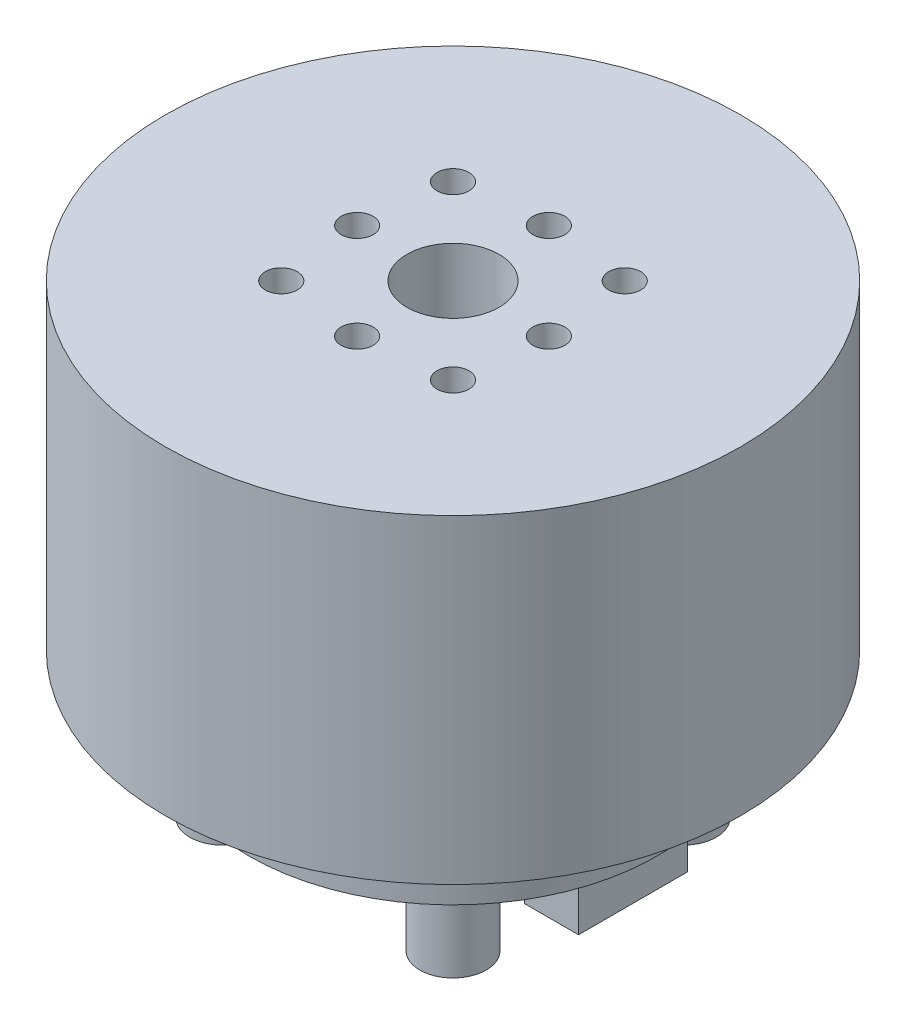
from build123d import *

# Parameters (mm, degrees)
SKETCH_1_R          = 22.5
EXTRUDE_1_DEPTH     = 25
SKETCH_2_R          = 15.96
EXTRUDE_2_DEPTH     = 6
EXTRUDE_3_DEPTH     = 5.4
SKETCH_4_W          = 4.21
SKETCH_4_H          = 8.54
SKETCH_4_H_2        = 4.27
EXTRUDE_4_DEPTH     = 4.13
SKETCH_5_R          = 1.25
CUT_EXTRUDE_1_DEPTH = 3
SKETCH_6_R          = 3.6
CUT_EXTRUDE_2_DEPTH = 25


with BuildPart() as part:
    # 草图1 → 凸台-拉伸1 (new body)
    with BuildSketch(Plane(origin=(0, 0, 0), x_dir=(1, 0, 0), z_dir=(0, 1, 0))):
        with Locations(Location((0, 0, 0), (0, 0, 270))):
            Circle(SKETCH_1_R)
    extrude(amount=EXTRUDE_1_DEPTH)

    # 草图2 → 凸台-拉伸2 (add)
    with BuildSketch(Plane.XZ):
        with Locations(Location((0, 0, 0), (0, 0, 270))):
            Circle(SKETCH_2_R)
    extrude(amount=EXTRUDE_2_DEPTH)

    # 草图3 → 凸台-拉伸3 (add)
    with BuildSketch(Plane.XZ.offset(6)):
        with BuildLine():
            ThreePointArc((-6.4, 9), (-10.838477631, 10.838477631), (-9, 6.4))
            Line((-9, 6.4), (-9, 7.6))
            ThreePointArc((-9, 7.6), (-9.989949494, 9.989949494), (-7.6, 9))
            Line((-7.6, 9), (-6.4, 9))
        make_face()
        with BuildLine():
            Line((-9, 7.6), (-9, 6.4))
            ThreePointArc((-9, 6.4), (-7.161522369, 7.161522369), (-6.4, 9))
            Line((-6.4, 9), (-7.6, 9))
            ThreePointArc((-7.6, 9), (-8.010050506, 8.010050506), (-9, 7.6))
        make_face()
        with BuildLine():
            ThreePointArc((6.4, 9), (7.161522369, 7.161522369), (9, 6.4))
            Line((9, 6.4), (9, 7.6))
            ThreePointArc((9, 7.6), (8.010050506, 8.010050506), (7.6, 9))
            Line((7.6, 9), (6.4, 9))
        make_face()
        with BuildLine():
            Line((9, 7.6), (9, 6.4))
            ThreePointArc((9, 6.4), (10.838477631, 7.161522369), (11.6, 9))
            ThreePointArc((11.6, 9), (9, 11.6), (6.4, 9))
            Line((6.4, 9), (7.6, 9))
            ThreePointArc((7.6, 9), (9, 10.4), (10.4, 9))
            ThreePointArc((10.4, 9), (9.989949494, 8.010050506), (9, 7.6))
        make_face()
        with BuildLine():
            ThreePointArc((9, -6.4), (7.161522369, -7.161522369), (6.4, -9))
            Line((6.4, -9), (7.6, -9))
            ThreePointArc((7.6, -9), (8.010050506, -8.010050506), (9, -7.6))
            Line((9, -7.6), (9, -6.4))
        make_face()
        with BuildLine():
            Line((7.6, -9), (6.4, -9))
            ThreePointArc((6.4, -9), (9, -11.6), (11.6, -9))
            ThreePointArc((11.6, -9), (10.838477631, -7.161522369), (9, -6.4))
            Line((9, -6.4), (9, -7.6))
            ThreePointArc((9, -7.6), (9.989949494, -8.010050506), (10.4, -9))
            ThreePointArc((10.4, -9), (9, -10.4), (7.6, -9))
        make_face()
        with BuildLine():
            ThreePointArc((-9, -7.6), (-8.010050506, -8.010050506), (-7.6, -9))
            Line((-7.6, -9), (-6.4, -9))
            ThreePointArc((-6.4, -9), (-7.161522369, -7.161522369), (-9, -6.4))
            Line((-9, -6.4), (-9, -7.6))
        make_face()
        with BuildLine():
            Line((-6.4, -9), (-7.6, -9))
            ThreePointArc((-7.6, -9), (-9.989949494, -9.989949494), (-9, -7.6))
            Line((-9, -7.6), (-9, -6.4))
            ThreePointArc((-9, -6.4), (-10.838477631, -10.838477631), (-6.4, -9))
        make_face()
    extrude(amount=EXTRUDE_3_DEPTH)

    # 草图4 → 凸台-拉伸4 (add)
    with BuildSketch(Plane.XZ.offset(6)):
        with Locations((-11.985, 0)):
            Rectangle(SKETCH_4_W, SKETCH_4_H)
        with Locations((11.985, -2.135)):
            Rectangle(SKETCH_4_W, SKETCH_4_H_2)
        with Locations((11.985, 2.135)):
            Rectangle(SKETCH_4_W, SKETCH_4_H_2)
    extrude(amount=EXTRUDE_4_DEPTH)

    # 草图5 → 切除-拉伸1 (cut)
    with BuildSketch(Plane(origin=(0, 25, 0), x_dir=(1, 0, 0), z_dir=(0, 1, 0))):
        with Locations(Location((7.5, 0, 0), (0, 0, 270))):
            Circle(SKETCH_5_R)
        with Locations(Location((-7.5, 0, 0), (0, 0, 270))):
            Circle(SKETCH_5_R)
        with Locations(Location((0, 7.5, 0), (0, 0, 270))):
            Circle(SKETCH_5_R)
        with Locations(Location((0, -7.5, 0), (0, 0, 270))):
            Circle(SKETCH_5_R)
        with Locations(Location((6.717514421, 6.717514421, 0), (0, 0, 270))):
            Circle(SKETCH_5_R)
        with Locations(Location((-6.717514421, -6.717514421, 0), (0, 0, 270))):
            Circle(SKETCH_5_R)
        with Locations(Location((6.717514421, -6.717514421, 0), (0, 0, 270))):
            Circle(SKETCH_5_R)
        with Locations(Location((-6.717514421, 6.717514421, 0), (0, 0, 270))):
            Circle(SKETCH_5_R)
    extrude(amount=-CUT_EXTRUDE_1_DEPTH, mode=Mode.SUBTRACT)

    # 草图6 → 切除-拉伸2 (cut)
    with BuildSketch(Plane(origin=(0, 25, 0), x_dir=(1, 0, 0), z_dir=(0, 1, 0))):
        with Locations(Location((0, 0, 0), (0, 0, 270))):
            Circle(SKETCH_6_R)
    extrude(amount=-CUT_EXTRUDE_2_DEPTH, mode=Mode.SUBTRACT)


solid = part.part
